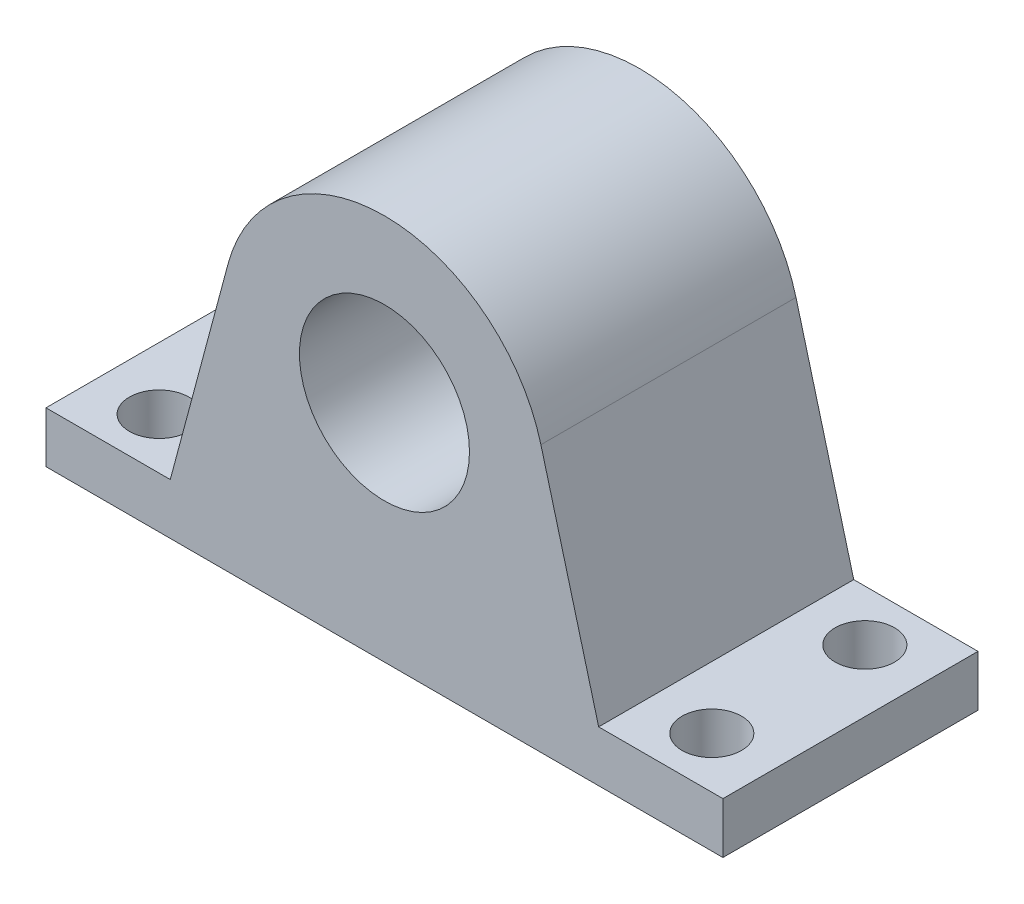
from build123d import *

# Parameters (mm, degrees)
BOSS_EXTRUDE1_DEPTH            = 30
F_20_0MM_DOWEL_HOLE1_D         = 20
F_20_0MM_DOWEL_HOLE1_DEPTH     = 74.0791
F_20_0MM_DOWEL_HOLE1_TIP       = 6.00860619
M8X1_0_TAPPED_HOLE1_AT_2_COUNT = 2
M8X1_0_TAPPED_HOLE1_AT_2_PITCH = 18


with BuildPart() as part:
    # Sketch1 → Boss-Extrude1 (new body)
    with BuildSketch(Plane.XY):
        with BuildLine():
            Line((0, 0), (-39.807538051, 0))
            Line((-39.807538051, 0), (-39.807538051, 6))
            Line((-39.807538051, 6), (-25.192461949, 6))
            Line((-25.192461949, 6), (-18.400886991, 31.346502809))
            ThreePointArc((-18.400886991, 31.346502809), (0, 45.466), (18.400886991, 31.346502809))
            Line((18.400886991, 31.346502809), (25.192461949, 6))
            Line((25.192461949, 6), (39.807538051, 6))
            Line((39.807538051, 6), (39.807538051, 0))
            Line((39.807538051, 0), (0, 0))
        make_face()
    extrude(amount=BOSS_EXTRUDE1_DEPTH)

    # Ø20.0mm Dowel Hole1
    with Locations(Plane(origin=(0, 26.416, 30), x_dir=(1, 0, 0), z_dir=(0, 0, 1))):
        with Locations((0, 0)):
            Hole(F_20_0MM_DOWEL_HOLE1_D / 2, depth=F_20_0MM_DOWEL_HOLE1_DEPTH)
            with Locations((0, 0, -(F_20_0MM_DOWEL_HOLE1_DEPTH + F_20_0MM_DOWEL_HOLE1_TIP / 2))):  # 118° drill point
                Cone(0, F_20_0MM_DOWEL_HOLE1_D / 2, F_20_0MM_DOWEL_HOLE1_TIP, mode=Mode.SUBTRACT)

    # Sketch6 → M8x1.0 Tapped Hole1 (revolve, cut)
    with BuildSketch(Plane(origin=(-32.5, 6, 6), x_dir=(0, 0, 1), z_dir=(1, 0, 0))):
        Polygon((0, 0), (0, 21.103012167), (3.5, 19), (3.5, 0), align=None)
    m8x1_0_tapped_hole1 = revolve(axis=Axis((-32.5, 12.35, 6), (0, -1, 0)), mode=Mode.SUBTRACT)

    # M8x1.0 Tapped Hole1 at 2: M8x1.0 Tapped Hole1 ×2
    with Locations(*[(0, 0, i * M8X1_0_TAPPED_HOLE1_AT_2_PITCH) for i in range(1, M8X1_0_TAPPED_HOLE1_AT_2_COUNT)]):
        add(m8x1_0_tapped_hole1, mode=Mode.SUBTRACT)

    # Mirror1: M8x1.0 Tapped Hole1 across plane
    add(m8x1_0_tapped_hole1.mirror(Plane(origin=(0, 0, 0), x_dir=(0, 0, 1), z_dir=(1, 0, 0))), mode=Mode.SUBTRACT)

    # Mirror1 copy 1 sketch → Mirror1 copy 1 (revolve, cut)
    with BuildSketch(Plane(origin=(32.5, 6, 24), x_dir=(0, 0, 1), z_dir=(-1, 0, 0))):
        Polygon((0, 0), (0, -21.103012167), (3.5, -19), (3.5, 0), align=None)
    revolve(axis=Axis((32.5, 12.35, 24), (0, 1, 0)), mode=Mode.SUBTRACT)


solid = part.part
